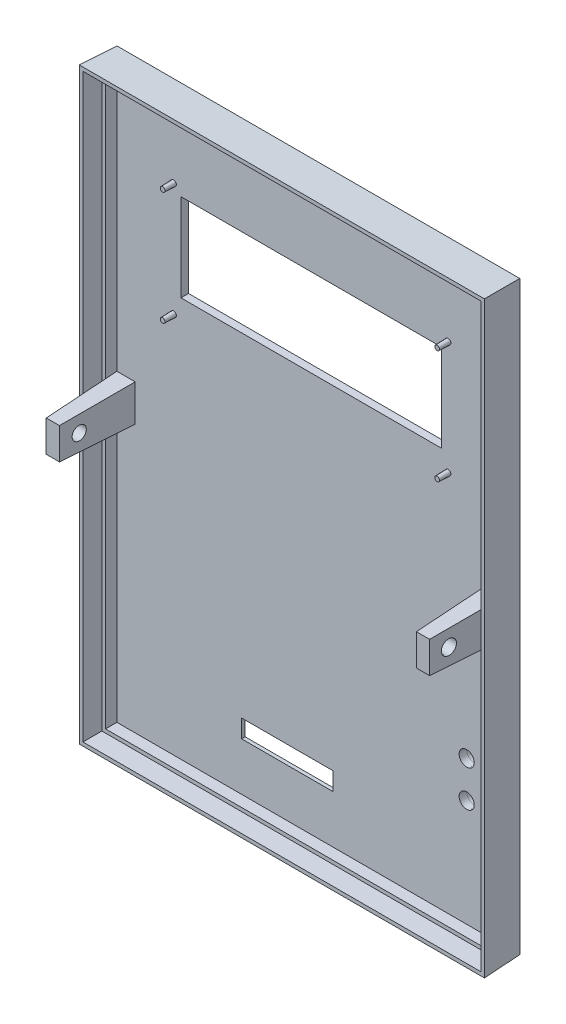
from build123d import *

# Parameters (mm, degrees)
SKETCH1_W                     = 110
SKETCH1_H                     = 160
BOSS_EXTRUDE1_DEPTH           = 10
BOSS_EXTRUDE1_DRAFT           = -2
SHELL1_T                      = -2
SKETCH3_W                     = 108.69841539
SKETCH3_H                     = 158.69841539
CUT_EXTRUDE3_DEPTH            = 5
CUT_EXTRUDE3_DRAFT            = -2
SKETCH4_W                     = 71
SKETCH4_H                     = 23.8
CUT_EXTRUDE4_DEPTH            = 2
CUT_EXTRUDE4_DRAFT            = 2
SKETCH5_R                     = 3
SKETCH5_R_2                   = 2
BOSS_EXTRUDE2_DEPTH           = 3
BOSS_EXTRUDE2_DRAFT           = 2
BOSS_EXTRUDE2_PROFILE_2_DEPTH = 3
BOSS_EXTRUDE2_PROFILE_2_DRAFT = 2
SKETCH8_R                     = 2
CUT_EXTRUDE5_DEPTH            = 2
CUT_EXTRUDE5_DRAFT            = 2
CUT_EXTRUDE5_PROFILE_2_DEPTH  = 2
CUT_EXTRUDE5_PROFILE_2_DRAFT  = 2
SKETCH10_R                    = 0.75
BOSS_EXTRUDE3_DEPTH           = 3
BOSS_EXTRUDE3_DRAFT           = 2
BOSS_EXTRUDE3_PROFILE_2_DEPTH = 3
BOSS_EXTRUDE3_PROFILE_2_DRAFT = 2
BOSS_EXTRUDE3_PROFILE_3_DEPTH = 3
BOSS_EXTRUDE3_PROFILE_3_DRAFT = 2
BOSS_EXTRUDE3_PROFILE_4_DEPTH = 3
BOSS_EXTRUDE3_PROFILE_4_DRAFT = 2
SKETCH13_W                    = 5
SKETCH13_H                    = 10
BOSS_EXTRUDE8_DEPTH           = 20
BOSS_EXTRUDE8_DRAFT           = 2
BOSS_EXTRUDE8_PROFILE_2_DEPTH = 20
BOSS_EXTRUDE8_PROFILE_2_DRAFT = 2
CUT_EXTRUDE8_REACH            = 138.446
SKETCH21_R                    = 2
CUT_EXTRUDE8_DRAFT            = -2
CUT_EXTRUDE9_REACH            = 138.446
SKETCH22_R                    = 2
CUT_EXTRUDE9_DRAFT            = -2
SKETCH27_W                    = 69
SKETCH27_H                    = 76
CUT_EXTRUDE10_DEPTH           = 1
CUT_EXTRUDE10_DRAFT           = -2
SKETCH28_W                    = 25
SKETCH28_H                    = 5
CUT_EXTRUDE11_DEPTH           = 1
CUT_EXTRUDE11_DRAFT           = -2


with BuildPart() as part:
    # Sketch1 → Boss-Extrude1 (with draft: the straight prism first)
    with BuildSketch(Plane.XY):
        Rectangle(SKETCH1_W, SKETCH1_H)
    extrude(amount=BOSS_EXTRUDE1_DEPTH)
    # Boss-Extrude1: the draft: its side faces are tilted about the plane it starts from
    boss_extrude1_sides = [part.faces().sort_by_distance(p)[0] for p in [
        (55, 0, 5),
        (0, 80, 5),
        (-55, 0, 5),
        (0, -80, 5),
    ]]
    draft(boss_extrude1_sides, Plane.XY, BOSS_EXTRUDE1_DRAFT)

    # Shell1
    shell1_openings = [part.faces().sort_by_distance(p)[0] for p in [
        (0, 0, 10),
    ]]
    offset(amount=SHELL1_T, openings=shell1_openings, kind=Kind.INTERSECTION)


with BuildPart() as cut_extrude3_tool:
    # Sketch3 → Cut-Extrude3 (with draft: the straight prism first)
    with BuildSketch(Plane.XY.offset(10)):
        Rectangle(SKETCH3_W, SKETCH3_H)
    extrude(amount=-CUT_EXTRUDE3_DEPTH)
    # Cut-Extrude3: the draft: its side faces are tilted about the plane it starts from
    cut_extrude3_sides = [cut_extrude3_tool.faces().sort_by_distance(p)[0] for p in [
        (54.349207695, 0, 7.5),
        (0, 79.349207695, 7.5),
        (-54.349207695, 0, 7.5),
        (0, -79.349207695, 7.5),
    ]]
    draft(cut_extrude3_sides, Plane.XY.offset(10), CUT_EXTRUDE3_DRAFT)


with BuildPart() as part_1:
    add(part.part)

    # Cut-Extrude3: cut by cut_extrude3_tool
    add(cut_extrude3_tool.part, mode=Mode.SUBTRACT)


with BuildPart() as cut_extrude4_tool:
    # Sketch4 → Cut-Extrude4 (with draft: the straight prism first)
    with BuildSketch(Plane(origin=(0, 0, 0), x_dir=(-1, 0, 0), z_dir=(0, 0, -1))):
        with Locations((0, 43.1)):
            Rectangle(SKETCH4_W, SKETCH4_H)
    extrude(amount=-CUT_EXTRUDE4_DEPTH)
    # Cut-Extrude4: the draft: its side faces are tilted about the plane it starts from
    cut_extrude4_sides = [cut_extrude4_tool.faces().sort_by_distance(p)[0] for p in [
        (-35.5, 43.1, 1),
        (0, 55, 1),
        (35.5, 43.1, 1),
        (0, 31.2, 1),
    ]]
    draft(cut_extrude4_sides, Plane(origin=(0, 0, 0), x_dir=(-1, 0, 0), z_dir=(0, 0, -1)), CUT_EXTRUDE4_DRAFT)


with BuildPart() as part_2:
    add(part_1.part)

    # Cut-Extrude4: cut by cut_extrude4_tool
    add(cut_extrude4_tool.part, mode=Mode.SUBTRACT)


with BuildPart() as boss_extrude2_tool:
    # Sketch5 → Boss-Extrude2 (with draft: the straight prism first)
    with BuildSketch(Plane(origin=(0, 0, 0), x_dir=(-1, 0, 0), z_dir=(0, 0, -1))):
        with Locations((-42.5, -38.8)):
            Circle(SKETCH5_R)
        with Locations((-42.5, -38.8)):
            Circle(SKETCH5_R_2, mode=Mode.SUBTRACT)
    extrude(amount=BOSS_EXTRUDE2_DEPTH)
    # Boss-Extrude2: the draft: its side faces are tilted about the plane it starts from
    boss_extrude2_sides = [boss_extrude2_tool.faces().sort_by_distance(p)[0] for p in [
        (45.5, -38.8, -1.5),
        (44.5, -38.8, -1.5),
    ]]
    draft(boss_extrude2_sides, Plane(origin=(0, 0, 0), x_dir=(-1, 0, 0), z_dir=(0, 0, -1)), BOSS_EXTRUDE2_DRAFT)


with BuildPart() as part_3:
    add(part_2.part)

    # Boss-Extrude2: add boss_extrude2_tool
    add(boss_extrude2_tool.part)


with BuildPart() as boss_extrude2_profile_2_tool:
    # Sketch5 → Boss-Extrude2 profile 2 (with draft: the straight prism first)
    with BuildSketch(Plane(origin=(0, 0, 0), x_dir=(-1, 0, 0), z_dir=(0, 0, -1))):
        with Locations((-42.5, -48.8)):
            Circle(SKETCH5_R)
        with Locations((-42.5, -48.8)):
            Circle(SKETCH5_R_2, mode=Mode.SUBTRACT)
    extrude(amount=BOSS_EXTRUDE2_PROFILE_2_DEPTH)
    # Boss-Extrude2 profile 2: the draft: its side faces are tilted about the plane it starts from
    boss_extrude2_profile_2_sides = [boss_extrude2_profile_2_tool.faces().sort_by_distance(p)[0] for p in [
        (45.5, -48.8, -1.5),
        (44.5, -48.8, -1.5),
    ]]
    draft(boss_extrude2_profile_2_sides, Plane(origin=(0, 0, 0), x_dir=(-1, 0, 0), z_dir=(0, 0, -1)), BOSS_EXTRUDE2_PROFILE_2_DRAFT)


with BuildPart() as part_4:
    add(part_3.part)

    # Boss-Extrude2 profile 2: add boss_extrude2_profile_2_tool
    add(boss_extrude2_profile_2_tool.part)


with BuildPart() as cut_extrude5_tool:
    # Sketch8 → Cut-Extrude5 (with draft: the straight prism first)
    with BuildSketch(Plane(origin=(0, 0, 0), x_dir=(-1, 0, 0), z_dir=(0, 0, -1))):
        with Locations((-42.5, -48.8)):
            Circle(SKETCH8_R)
    extrude(amount=-CUT_EXTRUDE5_DEPTH)
    # Cut-Extrude5: the draft: its side faces are tilted about the plane it starts from
    cut_extrude5_sides = [cut_extrude5_tool.faces().sort_by_distance(p)[0] for p in [
        (44.5, -48.8, 1),
    ]]
    draft(cut_extrude5_sides, Plane(origin=(0, 0, 0), x_dir=(-1, 0, 0), z_dir=(0, 0, -1)), CUT_EXTRUDE5_DRAFT)


with BuildPart() as part_5:
    add(part_4.part)

    # Cut-Extrude5: cut by cut_extrude5_tool
    add(cut_extrude5_tool.part, mode=Mode.SUBTRACT)


with BuildPart() as cut_extrude5_profile_2_tool:
    # Sketch8 → Cut-Extrude5 profile 2 (with draft: the straight prism first)
    with BuildSketch(Plane(origin=(0, 0, 0), x_dir=(-1, 0, 0), z_dir=(0, 0, -1))):
        with Locations((-42.5, -38.8)):
            Circle(SKETCH8_R)
    extrude(amount=-CUT_EXTRUDE5_PROFILE_2_DEPTH)
    # Cut-Extrude5 profile 2: the draft: its side faces are tilted about the plane it starts from
    cut_extrude5_profile_2_sides = [cut_extrude5_profile_2_tool.faces().sort_by_distance(p)[0] for p in [
        (44.5, -38.8, 1),
    ]]
    draft(cut_extrude5_profile_2_sides, Plane(origin=(0, 0, 0), x_dir=(-1, 0, 0), z_dir=(0, 0, -1)), CUT_EXTRUDE5_PROFILE_2_DRAFT)


with BuildPart() as part_6:
    add(part_5.part)

    # Cut-Extrude5 profile 2: cut by cut_extrude5_profile_2_tool
    add(cut_extrude5_profile_2_tool.part, mode=Mode.SUBTRACT)


with BuildPart() as boss_extrude3_tool:
    # Sketch10 → Boss-Extrude3 (with draft: the straight prism first)
    with BuildSketch(Plane.XY.offset(2)):
        with Locations((-37.569841539, 57.294841539)):
            Circle(SKETCH10_R)
    extrude(amount=BOSS_EXTRUDE3_DEPTH)
    # Boss-Extrude3: the draft: its side faces are tilted about the plane it starts from
    boss_extrude3_sides = [boss_extrude3_tool.faces().sort_by_distance(p)[0] for p in [
        (-38.319841539, 57.294841539, 3.5),
    ]]
    draft(boss_extrude3_sides, Plane.XY.offset(2), BOSS_EXTRUDE3_DRAFT)


with BuildPart() as part_7:
    add(part_6.part)

    # Boss-Extrude3: add boss_extrude3_tool
    add(boss_extrude3_tool.part)


with BuildPart() as boss_extrude3_profile_2_tool:
    # Sketch10 → Boss-Extrude3 profile 2 (with draft: the straight prism first)
    with BuildSketch(Plane.XY.offset(2)):
        with Locations((37.430158461, 57.294841539)):
            Circle(SKETCH10_R)
    extrude(amount=BOSS_EXTRUDE3_PROFILE_2_DEPTH)
    # Boss-Extrude3 profile 2: the draft: its side faces are tilted about the plane it starts from
    boss_extrude3_profile_2_sides = [boss_extrude3_profile_2_tool.faces().sort_by_distance(p)[0] for p in [
        (36.680158461, 57.294841539, 3.5),
    ]]
    draft(boss_extrude3_profile_2_sides, Plane.XY.offset(2), BOSS_EXTRUDE3_PROFILE_2_DRAFT)


with BuildPart() as part_8:
    add(part_7.part)

    # Boss-Extrude3 profile 2: add boss_extrude3_profile_2_tool
    add(boss_extrude3_profile_2_tool.part)


with BuildPart() as boss_extrude3_profile_3_tool:
    # Sketch10 → Boss-Extrude3 profile 3 (with draft: the straight prism first)
    with BuildSketch(Plane.XY.offset(2)):
        with Locations((37.430158461, 26.294841539)):
            Circle(SKETCH10_R)
    extrude(amount=BOSS_EXTRUDE3_PROFILE_3_DEPTH)
    # Boss-Extrude3 profile 3: the draft: its side faces are tilted about the plane it starts from
    boss_extrude3_profile_3_sides = [boss_extrude3_profile_3_tool.faces().sort_by_distance(p)[0] for p in [
        (36.680158461, 26.294841539, 3.5),
    ]]
    draft(boss_extrude3_profile_3_sides, Plane.XY.offset(2), BOSS_EXTRUDE3_PROFILE_3_DRAFT)


with BuildPart() as part_9:
    add(part_8.part)

    # Boss-Extrude3 profile 3: add boss_extrude3_profile_3_tool
    add(boss_extrude3_profile_3_tool.part)


with BuildPart() as boss_extrude3_profile_4_tool:
    # Sketch10 → Boss-Extrude3 profile 4 (with draft: the straight prism first)
    with BuildSketch(Plane.XY.offset(2)):
        with Locations((-37.569841539, 26.294841539)):
            Circle(SKETCH10_R)
    extrude(amount=BOSS_EXTRUDE3_PROFILE_4_DEPTH)
    # Boss-Extrude3 profile 4: the draft: its side faces are tilted about the plane it starts from
    boss_extrude3_profile_4_sides = [boss_extrude3_profile_4_tool.faces().sort_by_distance(p)[0] for p in [
        (-38.319841539, 26.294841539, 3.5),
    ]]
    draft(boss_extrude3_profile_4_sides, Plane.XY.offset(2), BOSS_EXTRUDE3_PROFILE_4_DRAFT)


with BuildPart() as part_10:
    add(part_9.part)

    # Boss-Extrude3 profile 4: add boss_extrude3_profile_4_tool
    add(boss_extrude3_profile_4_tool.part)


with BuildPart() as boss_extrude8_tool:
    # Sketch13 → Boss-Extrude8 (with draft: the straight prism first)
    with BuildSketch(Plane.XY.offset(2)):
        with Locations((-50.56862245, 0)):
            Rectangle(SKETCH13_W, SKETCH13_H)
    extrude(amount=BOSS_EXTRUDE8_DEPTH)
    # Boss-Extrude8: the draft: its side faces are tilted about the plane it starts from
    boss_extrude8_sides = [boss_extrude8_tool.faces().sort_by_distance(p)[0] for p in [
        (-50.56862245, 5, 12),
        (-53.06862245, 0, 12),
        (-50.56862245, -5, 12),
        (-48.06862245, 0, 12),
    ]]
    draft(boss_extrude8_sides, Plane.XY.offset(2), BOSS_EXTRUDE8_DRAFT)


with BuildPart() as part_11:
    add(part_10.part)

    # Boss-Extrude8: add boss_extrude8_tool
    add(boss_extrude8_tool.part)


with BuildPart() as boss_extrude8_profile_2_tool:
    # Sketch13 → Boss-Extrude8 profile 2 (with draft: the straight prism first)
    with BuildSketch(Plane.XY.offset(2)):
        with Locations((50.56862245, 0)):
            Rectangle(SKETCH13_W, SKETCH13_H)
    extrude(amount=BOSS_EXTRUDE8_PROFILE_2_DEPTH)
    # Boss-Extrude8 profile 2: the draft: its side faces are tilted about the plane it starts from
    boss_extrude8_profile_2_sides = [boss_extrude8_profile_2_tool.faces().sort_by_distance(p)[0] for p in [
        (50.56862245, -5, 12),
        (53.06862245, 0, 12),
        (50.56862245, 5, 12),
        (48.06862245, 0, 12),
    ]]
    draft(boss_extrude8_profile_2_sides, Plane.XY.offset(2), BOSS_EXTRUDE8_PROFILE_2_DRAFT)


with BuildPart() as part_12:
    add(part_11.part)

    # Boss-Extrude8 profile 2: add boss_extrude8_profile_2_tool
    add(boss_extrude8_profile_2_tool.part)

    # Cut-Extrude8: up to this plane
    cut_extrude8_end = Plane(origin=(-48.06862245, 5, 2), z_dir=(0.9993908270190958, 0, 0.034899496702501004))



with BuildPart() as cut_extrude8_long_prism_1:
    # Sketch21 → Cut-Extrude8 (the long prism of profile 1, to be tilted and cut off)
    with BuildSketch(Plane(origin=(-53.073742676, 0, 1.853375934), x_dir=(0.03489949670250101, 0, 0.9993908270190958), z_dir=(-0.9993908270190958, 0, 0.03489949670250101))):
        with Locations((15.062248779, 0)):
            Circle(SKETCH21_R)
    extrude(amount=-CUT_EXTRUDE8_REACH)
    cut_extrude8_tool1_sides = [cut_extrude8_long_prism_1.faces().sort_by_distance(p)[0] for p in [
        (16.562954451, 0, 12.491819684),
    ]]
    draft(cut_extrude8_tool1_sides, Plane(origin=(-53.073742676, 0, 1.853375934), x_dir=(0.03489949670250101, 0, 0.9993908270190958), z_dir=(-0.9993908270190958, 0, 0.03489949670250101)), CUT_EXTRUDE8_DRAFT)  # the draft: side faces tilted about the start plane


with BuildPart() as part_13:
    add(part_12.part)
    cut_extrude8_tool1 = split(cut_extrude8_long_prism_1.part, bisect_by=cut_extrude8_end, keep=Keep.BOTH, mode=Mode.PRIVATE)
    add(cut_extrude8_tool1.solids().sort_by_distance((-52.548078, 0, 16.906449))[0], mode=Mode.SUBTRACT)

    # Cut-Extrude9: up to this plane
    cut_extrude9_end = Plane(origin=(48.06862245, -5, 2), z_dir=(-0.9993908270190958, 0, 0.034899496702501004))



with BuildPart() as cut_extrude9_long_prism_1:
    # Sketch22 → Cut-Extrude9 (the long prism of profile 1, to be tilted and cut off)
    with BuildSketch(Plane(origin=(53.073742676, 0, 1.853375934), x_dir=(0.03489949670250101, 0, -0.9993908270190958), z_dir=(0.9993908270190958, 0, 0.03489949670250101))):
        with Locations((-15.062248779, 0)):
            Circle(SKETCH22_R)
    extrude(amount=-CUT_EXTRUDE9_REACH)
    cut_extrude9_tool1_sides = [cut_extrude9_long_prism_1.faces().sort_by_distance(p)[0] for p in [
        (-16.702552438, 0, 16.489382992),
    ]]
    draft(cut_extrude9_tool1_sides, Plane(origin=(53.073742676, 0, 1.853375934), x_dir=(0.03489949670250101, 0, -0.9993908270190958), z_dir=(0.9993908270190958, 0, 0.03489949670250101)), CUT_EXTRUDE9_DRAFT)  # the draft: side faces tilted about the start plane


with BuildPart() as part_14:
    add(part_13.part)
    cut_extrude9_tool1 = split(cut_extrude9_long_prism_1.part, bisect_by=cut_extrude9_end, keep=Keep.BOTH, mode=Mode.PRIVATE)
    add(cut_extrude9_tool1.solids().sort_by_distance((52.548078, 0, 16.906449))[0], mode=Mode.SUBTRACT)


with BuildPart() as cut_extrude10_tool:
    # Sketch27 → Cut-Extrude10 (with draft: the straight prism first)
    with BuildSketch(Plane(origin=(0, 0, 0), x_dir=(-1, 0, 0), z_dir=(0, 0, -1))):
        with Locations((5.5, -31.8)):
            Rectangle(SKETCH27_W, SKETCH27_H)
    extrude(amount=-CUT_EXTRUDE10_DEPTH)
    # Cut-Extrude10: the draft: its side faces are tilted about the plane it starts from
    cut_extrude10_sides = [cut_extrude10_tool.faces().sort_by_distance(p)[0] for p in [
        (-40, -31.8, 0.5),
        (-5.5, 6.2, 0.5),
        (29, -31.8, 0.5),
        (-5.5, -69.8, 0.5),
    ]]
    draft(cut_extrude10_sides, Plane(origin=(0, 0, 0), x_dir=(-1, 0, 0), z_dir=(0, 0, -1)), CUT_EXTRUDE10_DRAFT)


with BuildPart() as part_15:
    add(part_14.part)

    # Cut-Extrude10: cut by cut_extrude10_tool
    add(cut_extrude10_tool.part, mode=Mode.SUBTRACT)


with BuildPart() as cut_extrude11_tool:
    # Sketch28 → Cut-Extrude11 (with draft: the straight prism first)
    with BuildSketch(Plane(origin=(0, 0, 1), x_dir=(-1, 0, 0), z_dir=(0, 0, -1))):
        with Locations((6.534920769, -62.465079231)):
            Rectangle(SKETCH28_W, SKETCH28_H)
    extrude(amount=-CUT_EXTRUDE11_DEPTH)
    # Cut-Extrude11: the draft: its side faces are tilted about the plane it starts from
    cut_extrude11_sides = [cut_extrude11_tool.faces().sort_by_distance(p)[0] for p in [
        (-6.534920769, -59.965079231, 1.5),
        (5.965079231, -62.465079231, 1.5),
        (-6.534920769, -64.965079231, 1.5),
        (-19.034920769, -62.465079231, 1.5),
    ]]
    draft(cut_extrude11_sides, Plane(origin=(0, 0, 1), x_dir=(-1, 0, 0), z_dir=(0, 0, -1)), CUT_EXTRUDE11_DRAFT)


with BuildPart() as part_16:
    add(part_15.part)

    # Cut-Extrude11: cut by cut_extrude11_tool
    add(cut_extrude11_tool.part, mode=Mode.SUBTRACT)


solid = part_16.part
